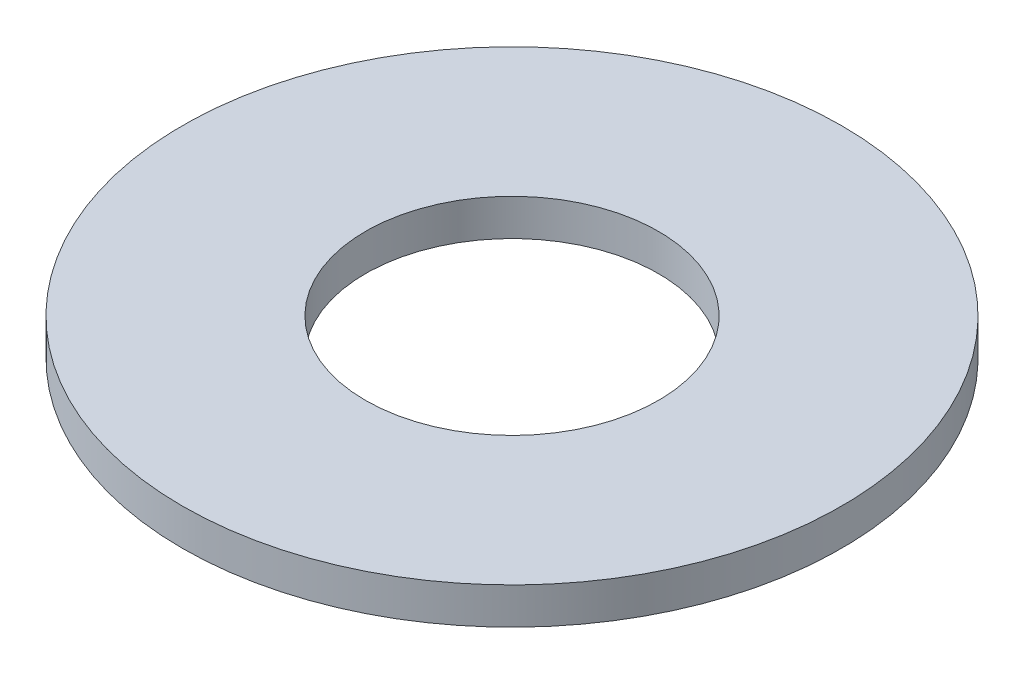
from build123d import *

# Parameters (mm, degrees)
SKETCH_1_R      = 4.5
SKETCH_1_R_2    = 2
EXTRUDE_1_DEPTH = 0.5


with BuildPart() as part:
    # 草图1 → 凸台-拉伸1 (new body)
    with BuildSketch(Plane(origin=(0, 0, 0), x_dir=(1, 0, 0), z_dir=(0, 1, 0))):
        with Locations(Location((0, 0, 0), (0, 0, 270))):
            Circle(SKETCH_1_R)
        with Locations(Location((0, 0, 0), (0, 0, 270))):
            Circle(SKETCH_1_R_2, mode=Mode.SUBTRACT)
    extrude(amount=EXTRUDE_1_DEPTH)


solid = part.part
